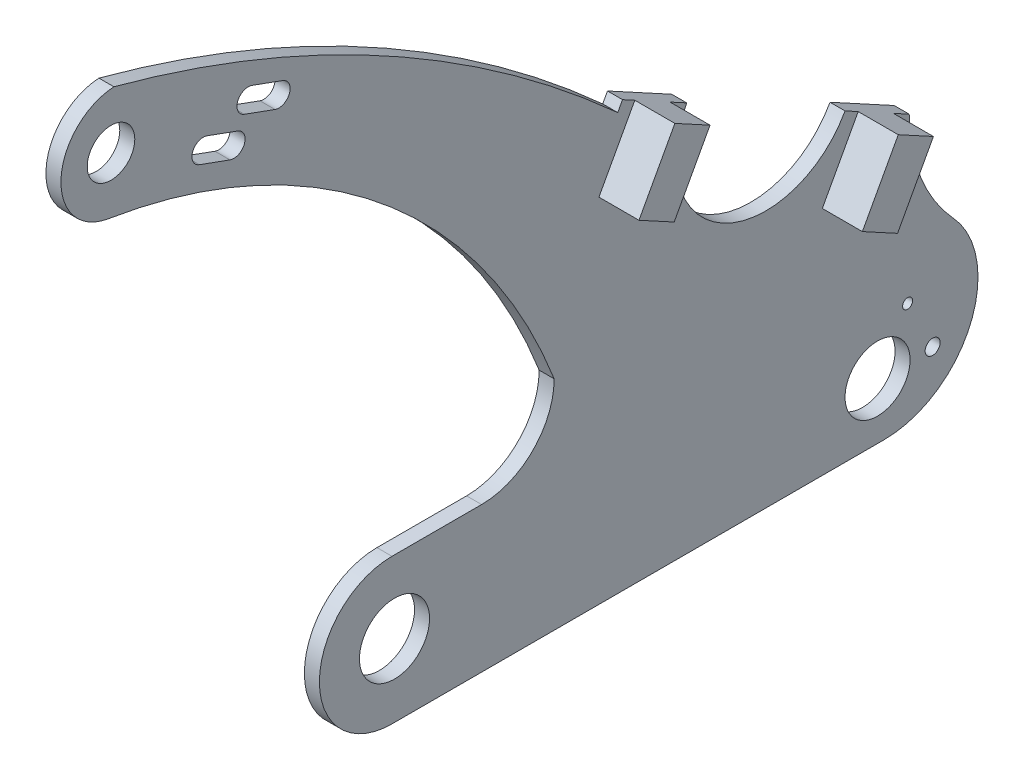
from build123d import *

# Parameters (mm, degrees)
SKETCH1_R           = 1.5
SKETCH1_R_2         = 1
SKETCH1_R_3         = 7
SKETCH1_R_4         = 4.75
BOSS_EXTRUDE1_DEPTH = 3
BOSS_EXTRUDE2_DEPTH = 8
SKETCH4_R           = 6.5
CUT_EXTRUDE1_DEPTH  = 10


with BuildPart() as part:
    # Sketch1 → Boss-Extrude1 (new body)
    with BuildSketch(Plane(origin=(0, 0, 0), x_dir=(0, 0, -1), z_dir=(1, 0, 0))):
        with BuildLine():
            Line((-49.159345461, 0), (49.159345461, 0))
            ThreePointArc((49.159345461, 0), (66.340654539, 11.242329364), (62.91845049, 31.487720707))
            ThreePointArc((62.91845049, 31.487720707), (56.432557087, 41.829379484), (54.166473214, 53.824444444))
            Line((54.166473214, 53.824444444), (41.340654539, 60.8))
            ThreePointArc((41.340654539, 60.8), (16.928001378, 53.587346839), (9.715348216, 78))
            Line((9.715348216, 78), (-3.110470459, 84.975555556))
            Line((-3.110470459, 84.975555556), (-4.066026015, 83.218594093))
            ThreePointArc((-4.066026015, 83.218594093), (-51.126972403, 116.596460909), (-104.705915866, 138))
            ThreePointArc((-104.705915866, 138), (-115.275757126, 127.38864025), (-105.87300769, 115.730561375))
            ThreePointArc((-105.87300769, 115.730561375), (-51.706077225, 91.471635272), (-16.759345461, 43.5))
            ThreePointArc((-16.759345461, 43.5), (-21.006297134, 33.246951673), (-31.259345461, 29))
            Line((-31.259345461, 29), (-49.159345461, 29))
            ThreePointArc((-49.159345461, 29), (-63.659345461, 14.5), (-49.159345461, 0))
        make_face()
        with Locations((58.840654539, 11.242329364)):
            Circle(SKETCH1_R, mode=Mode.SUBTRACT)
        with Locations((53.840654539, 21.242329364)):
            Circle(SKETCH1_R_2, mode=Mode.SUBTRACT)
        with Locations((-48.659345461, 14.5)):
            Circle(SKETCH1_R_3, mode=Mode.SUBTRACT)
        with Locations((-105.289461778, 126.865280687)):
            Circle(SKETCH1_R_4, mode=Mode.SUBTRACT)
        with BuildLine():
            Line((45.840654539, 15.742329364), (47.840654539, 15.742329364))
            ThreePointArc((47.840654539, 15.742329364), (52.340654539, 11.242329364), (47.840654539, 6.742329364))
            Line((47.840654539, 6.742329364), (45.840654539, 6.742329364))
            ThreePointArc((45.840654539, 6.742329364), (41.340654539, 11.242329364), (45.840654539, 15.742329364))
        make_face(mode=Mode.SUBTRACT)
        with BuildLine():
            Line((-86.096000708, 120.210043762), (-79.987998673, 117.98691283))
            ThreePointArc((-79.987998673, 117.98691283), (-78.643235599, 115.103059111), (-81.527089318, 113.758296037))
            Line((-81.527089318, 113.758296037), (-87.635091353, 115.981426968))
            ThreePointArc((-87.635091353, 115.981426968), (-88.979854428, 118.865280687), (-86.096000708, 120.210043762))
        make_face(mode=Mode.SUBTRACT)
        with BuildLine():
            Line((-77.104144954, 124.438660555), (-70.996142919, 122.215529624))
            ThreePointArc((-70.996142919, 122.215529624), (-69.651379845, 119.331675904), (-72.535233564, 117.98691283))
            Line((-72.535233564, 117.98691283), (-78.643235599, 120.210043762))
            ThreePointArc((-78.643235599, 120.210043762), (-79.987998673, 123.093897481), (-77.104144954, 124.438660555))
        make_face(mode=Mode.SUBTRACT)
    extrude(amount=BOSS_EXTRUDE1_DEPTH)

    # Sketch2 → Boss-Extrude2 (add)
    with BuildSketch(Plane(origin=(3, 0, 0), x_dir=(0, 0, -1), z_dir=(1, 0, 0))):
        Polygon((43.976096732, 59.366666667), (51.003942582, 55.544444444), (43.837275915, 42.367233477), (36.809430066, 46.189455699), align=None)
        Polygon((-0.650724412, 83.637777778), (6.377121438, 79.815555556), (-0.789545229, 66.638344588), (-7.817391078, 70.46056681), align=None)
    extrude(amount=BOSS_EXTRUDE2_DEPTH)

    # Sketch4 → Cut-Extrude1 (cut)
    with BuildSketch(Plane(origin=(3, 0, 0), x_dir=(0, 0, -1), z_dir=(1, 0, 0))):
        with Locations((47.840654539, 11.242329364)):
            Circle(SKETCH4_R)
    extrude(amount=-CUT_EXTRUDE1_DEPTH, mode=Mode.SUBTRACT)


solid = part.part
